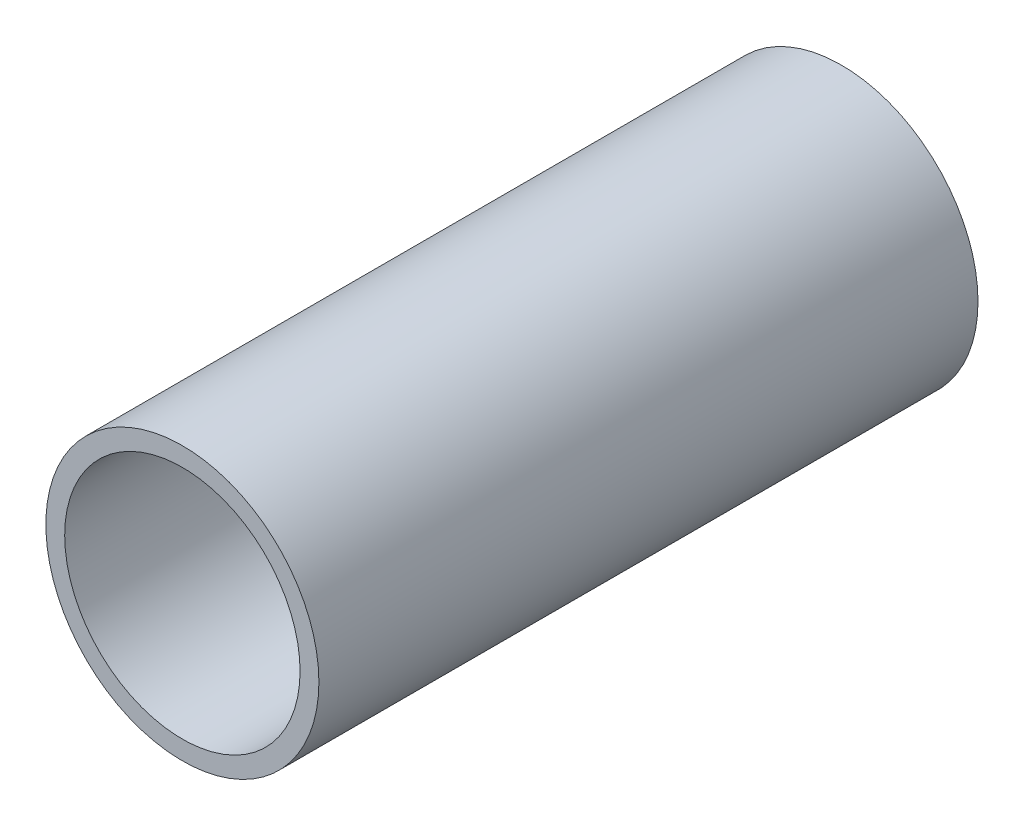
from build123d import *

# Parameters (mm, degrees)
SKETCH1_R           = 14.5
SKETCH1_R_2         = 12.5
BOSS_EXTRUDE1_DEPTH = 70


with BuildPart() as part:
    # Sketch1 → Boss-Extrude1 (new body)
    with BuildSketch(Plane.XY):
        Circle(SKETCH1_R)
        Circle(SKETCH1_R_2, mode=Mode.SUBTRACT)
    extrude(amount=BOSS_EXTRUDE1_DEPTH)


solid = part.part
